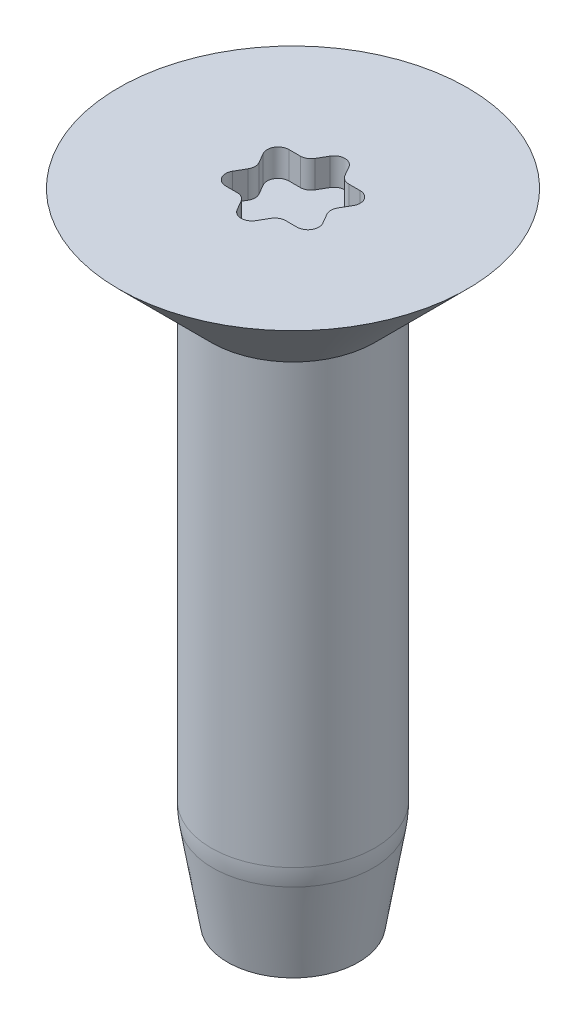
from build123d import *

# Parameters (mm, degrees)
SKETCH2_R           = 1.5
BOSS_EXTRUDE1_DEPTH = 10
CUT_EXTRUDE1_DEPTH  = 0.5
FILLET1_R           = 0.2
FILLET3_R           = 2


with BuildPart() as part:
    # Sketch1 → Revolve1 (revolve)
    with BuildSketch(Plane.XY, mode=Mode.PRIVATE) as revolve1_sk:
        Polygon((0, 0), (0, 1.7), (3.2, 1.7), (1.5, 0), align=None)
    revolve(revolve1_sk.sketch.rotate(Axis((0, 50, 0), (0, -1, 0)), 90), axis=Axis((0, 50, 0), (0, -1, 0)))

    # Sketch2 → Boss-Extrude1 (add)
    with BuildSketch(Plane.XZ):
        with Locations(Location((0, 0, 0), (0, 0, 270))):
            Circle(SKETCH2_R)
    extrude(amount=BOSS_EXTRUDE1_DEPTH)

    # Sketch3 → Cut-Revolve1 (revolve, cut)
    with BuildSketch(Plane.XY, mode=Mode.PRIVATE) as cut_revolve1_sk:
        Polygon((1.5, -8.2), (1.2, -10), (1.5, -10), align=None)
    revolve(cut_revolve1_sk.sketch.rotate(Axis((0, 0, 0), (0, -1, 0)), 180), axis=Axis((0, 0, 0), (0, -1, 0)), mode=Mode.SUBTRACT)

    # Sketch4 → Cut-Extrude1 (cut)
    with BuildSketch(Plane(origin=(0, 1.7, 0), x_dir=(1, 0, 0), z_dir=(0, 1, 0))):
        Polygon((0, 1.152050808), (0.330273688, 0.58), (1, 0.58), (0.665136844, 0), (1, -0.58), (0.330273688, -0.58), (0, -1.152050808), (-0.330273688, -0.58), (-1, -0.58), (-0.665136844, 0), (-1, 0.58), (-0.330273688, 0.58), align=None)
    extrude(amount=-CUT_EXTRUDE1_DEPTH, mode=Mode.SUBTRACT)

    # Fillet1
    fillet1_edges = [part.edges().sort_by_distance(p)[0] for p in [
        (-0.330273688, 1.45, -0.58),
        (0, 1.45, -1.152050808),
        (0.330273688, 1.45, -0.58),
        (1, 1.45, -0.58),
        (0.665136844, 1.45, 0),
        (1, 1.45, 0.58),
        (0.330273688, 1.45, 0.58),
        (0, 1.45, 1.152050808),
        (-0.330273688, 1.45, 0.58),
        (-1, 1.45, 0.58),
        (-0.665136844, 1.45, 0),
        (-1, 1.45, -0.58),
    ]]
    fillet(fillet1_edges, radius=FILLET1_R)

    # Fillet3
    fillet3_edges = [part.edges().sort_by_distance(p)[0] for p in [
        (-1.060660172, -8.2, -1.060660172),
    ]]
    fillet(fillet3_edges, radius=FILLET3_R)


solid = part.part
